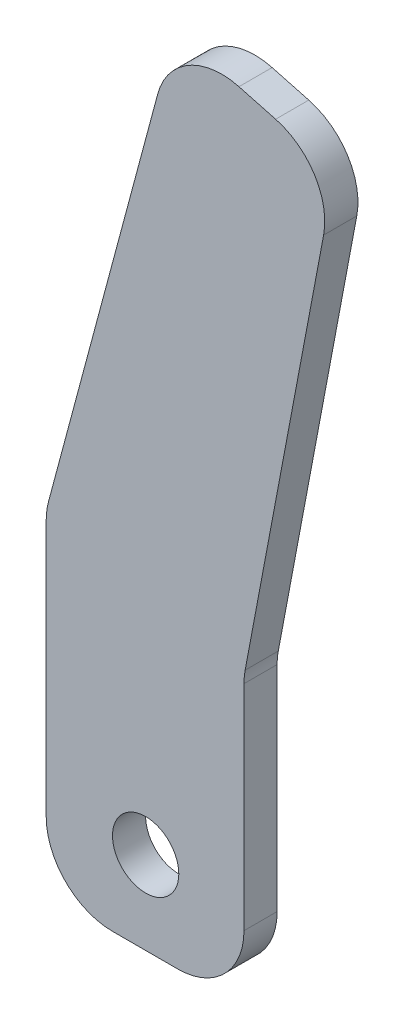
from build123d import *

# Parameters (mm, degrees)
SKETCH1_R           = 1
BOSS_EXTRUDE1_DEPTH = 1
FILLET1_R           = 2
FILLET2_R           = 2
FILLET3_R           = 2
FILLET4_R           = 2
FILLET5_R           = 2
FILLET6_R           = 2


with BuildPart() as part:
    # Sketch1 → Boss-Extrude1 (new body)
    with BuildSketch(Plane.XY):
        Polygon((0, 10), (3.882285677, 24.488887394), (8.711914808, 23.194792169), (5.965925826, 8.639463055), (5.965925826, 8.027846959), (5.965925826, 0), (0, 0), align=None)
        with Locations((2.999793512, 2.5)):
            Circle(SKETCH1_R, mode=Mode.SUBTRACT)
    extrude(amount=BOSS_EXTRUDE1_DEPTH)

    # Fillet1
    fillet1_edges = [part.edges().sort_by_distance(p)[0] for p in [
        (5.965925826, 0, 0.5),
    ]]
    fillet(fillet1_edges, radius=FILLET1_R)

    # Fillet2
    fillet2_edges = [part.edges().sort_by_distance(p)[0] for p in [
        (0, 0, 0.5),
    ]]
    fillet(fillet2_edges, radius=FILLET2_R)

    # Fillet3
    fillet3_edges = [part.edges().sort_by_distance(p)[0] for p in [
        (8.711914808, 23.194792169, 0.5),
    ]]
    fillet(fillet3_edges, radius=FILLET3_R)

    # Fillet4
    fillet4_edges = [part.edges().sort_by_distance(p)[0] for p in [
        (3.882285677, 24.488887394, 0.5),
    ]]
    fillet(fillet4_edges, radius=FILLET4_R)

    # Fillet5
    fillet5_edges = [part.edges().sort_by_distance(p)[0] for p in [
        (0, 10, 0.5),
    ]]
    fillet(fillet5_edges, radius=FILLET5_R)

    # Fillet6
    fillet6_edges = [part.edges().sort_by_distance(p)[0] for p in [
        (5.965925826, 8.639463055, 0.5),
    ]]
    fillet(fillet6_edges, radius=FILLET6_R)


solid = part.part
